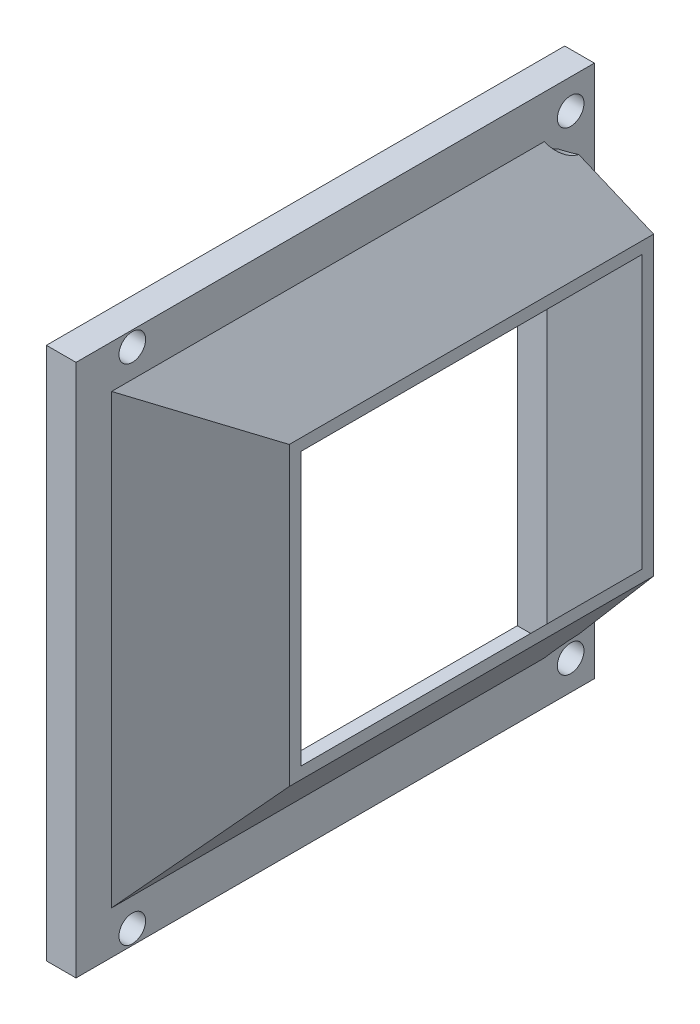
from build123d import *

# Parameters (mm, degrees)
SKETCH1_W            = 87.5
SKETCH1_H            = 90
SKETCH1_W_2          = 71.5
SKETCH1_H_2          = 71.5
BOSS_EXTRUDE1_DEPTH  = 5
M4_CLEARANCE_HOLE1_D = 4.5
BOSS_EXTRUDE2_DEPTH  = 90
BOSS_EXTRUDE3_DEPTH  = 87.5
CUT_EXTRUDE1_START   = -81.5
CUT_EXTRUDE1_DEPTH   = 81.5
CUT_EXTRUDE2_START   = -82.75
CUT_EXTRUDE2_DEPTH   = 75.5
SKETCH8_R            = 5
CUT_EXTRUDE3_DEPTH   = 10


with BuildPart() as part:
    # Sketch1 → Boss-Extrude1 (new body)
    with BuildSketch(Plane(origin=(0, 0, 0), x_dir=(0, 0, -1), z_dir=(1, 0, 0))):
        Rectangle(SKETCH1_W, SKETCH1_H)
        Rectangle(SKETCH1_W_2, SKETCH1_H_2, mode=Mode.SUBTRACT)
    extrude(amount=BOSS_EXTRUDE1_DEPTH)

    # M4 Clearance Hole1 (through all)
    with Locations(Plane(origin=(5, 0, 0), x_dir=(0, 0, -1), z_dir=(1, 0, 0))):
        with Locations((-34.25, 42.5), (39.75, 40)):
            m4_clearance_hole1 = Hole(M4_CLEARANCE_HOLE1_D / 2)

    # Mirror1: M4 Clearance Hole1 across plane
    add(m4_clearance_hole1.mirror(Plane.ZX), mode=Mode.SUBTRACT)

    # Sketch4 → Boss-Extrude2 (add)
    with BuildSketch(Plane(origin=(0, 45, 0), x_dir=(1, 0, 0), z_dir=(0, 1, 0))):
        Polygon((5, 35.75), (15, 41.75), (15, 43.75), (5, 37.75), align=None)
        Polygon((5, -35.75), (15, -15.75), (15, -17.75), (5, -37.75), align=None)
    extrude(amount=-BOSS_EXTRUDE2_DEPTH)

    # Sketch5 → Boss-Extrude3 (add)
    with BuildSketch(Plane(origin=(0, 0, -43.75), x_dir=(-1, 0, 0), z_dir=(0, 0, -1))):
        Polygon((-5, 35.75), (-15, 23), (-15, 25), (-5, 37.75), align=None)
        Polygon((-5, -37.75), (-15, -25), (-15, -23), (-5, -35.75), align=None)
    extrude(amount=-BOSS_EXTRUDE3_DEPTH)

    # Sketch6 → Cut-Extrude1 (cut)
    with BuildSketch(Plane(origin=(0, 0, -43.75), x_dir=(-1, 0, 0), z_dir=(0, 0, -1)).offset(CUT_EXTRUDE1_START)):
        Polygon((-5, 45), (-15, 45), (-15, 25), (-5, 37.75), align=None)
        Polygon((-15, -25), (-15, -45), (-5, -45), (-5, -37.75), align=None)
    extrude(amount=CUT_EXTRUDE1_DEPTH, mode=Mode.SUBTRACT)

    # Sketch7 → Cut-Extrude2 (cut)
    with BuildSketch(Plane(origin=(0, 45, 0), x_dir=(1, 0, 0), z_dir=(0, 1, 0)).offset(CUT_EXTRUDE2_START)):
        Polygon((5, -43.75), (15, -43.75), (15, -17.75), (5, -37.75), align=None)
        Polygon((5, 43.75), (15, 43.75), (5, 37.75), align=None)
    extrude(amount=CUT_EXTRUDE2_DEPTH, mode=Mode.SUBTRACT)

    # Sketch8 → Cut-Extrude3 (cut)
    with BuildSketch(Plane(origin=(5, 0, 0), x_dir=(0, 0, -1), z_dir=(1, 0, 0))):
        with Locations((39.75, 40)):
            Circle(SKETCH8_R)
        with Locations((39.75, -40)):
            Circle(SKETCH8_R)
    extrude(amount=CUT_EXTRUDE3_DEPTH, mode=Mode.SUBTRACT)


solid = part.part
